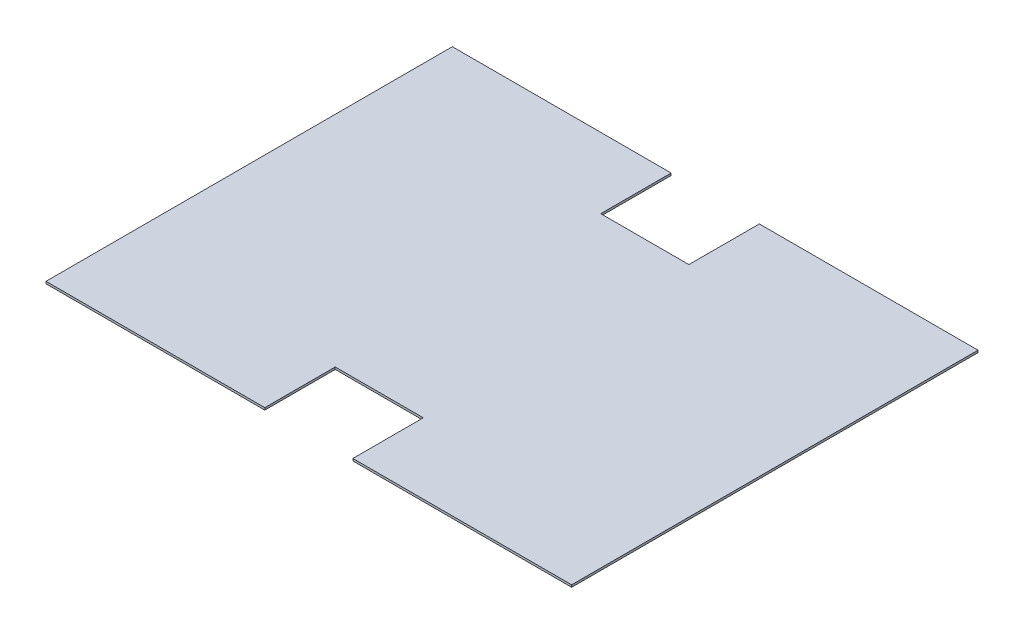
from build123d import *

# Parameters (mm, degrees)
SKETCH1_W           = 758.19
SKETCH1_H           = 586.105
BOSS_EXTRUDE1_DEPTH = 3.175
CUT_EXTRUDE1_REACH  = 481.169
SKETCH2_W           = 127
SKETCH2_H           = 101.6
SKETCH2_W_2         = 127.178209898


with BuildPart() as part:
    # Sketch1 → Boss-Extrude1 (new body)
    with BuildSketch(Plane(origin=(0, 0, 0), x_dir=(1, 0, 0), z_dir=(0, 1, 0))):
        Rectangle(SKETCH1_W, SKETCH1_H)
    extrude(amount=BOSS_EXTRUDE1_DEPTH)

    # Sketch2 → Cut-Extrude1 (cut, up to next)
    with BuildSketch(Plane(origin=(0, 3.175, 0), x_dir=(1, 0, 0), z_dir=(0, 1, 0)), mode=Mode.PRIVATE) as cut_extrude1_sk1:
        with Locations((0, -242.2525)):
            Rectangle(SKETCH2_W, SKETCH2_H)
    cut_extrude1_tool1 = extrude(cut_extrude1_sk1.sketch, amount=-CUT_EXTRUDE1_REACH, mode=Mode.PRIVATE) & part.part
    # Sketch2 → Cut-Extrude1 (cut, up to next)
    with BuildSketch(Plane(origin=(0, 3.175, 0), x_dir=(1, 0, 0), z_dir=(0, 1, 0)), mode=Mode.PRIVATE) as cut_extrude1_sk2:
        with Locations((0.089104949, 242.2525)):
            Rectangle(SKETCH2_W_2, SKETCH2_H)
    cut_extrude1_tool2 = extrude(cut_extrude1_sk2.sketch, amount=-CUT_EXTRUDE1_REACH, mode=Mode.PRIVATE) & part.part
    add(cut_extrude1_tool1.solids().sort_by_distance((0, 3.175, 242.2525))[0], mode=Mode.SUBTRACT)
    add(cut_extrude1_tool2.solids().sort_by_distance((0.089105, 3.175, -242.2525))[0], mode=Mode.SUBTRACT)


solid = part.part
